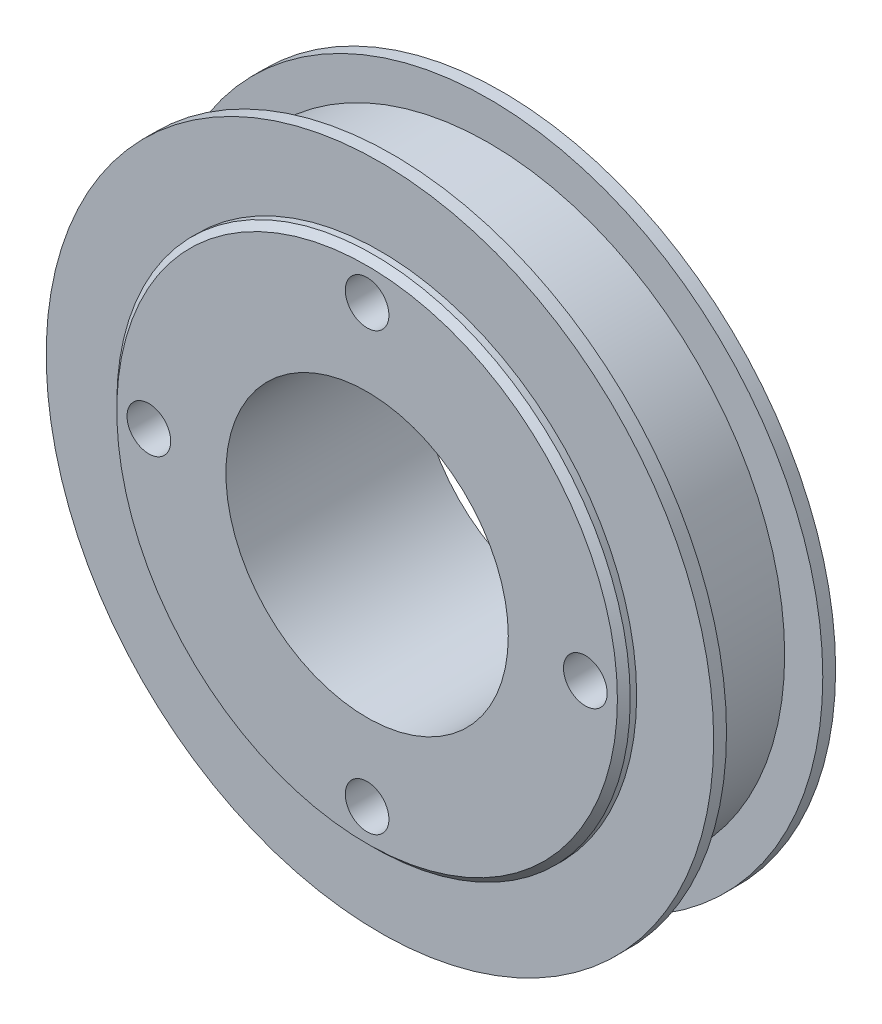
from build123d import *

# Parameters (mm, degrees)
SKETCH1_R                   = 13
BOSS_EXTRUDE1_DEPTH         = 3.5
SKETCH2_R                   = 20
BOSS_EXTRUDE2_DEPTH         = 1
SKETCH3_R                   = 26
BOSS_EXTRUDE3_DEPTH         = 1
SKETCH4_R                   = 23.03
BOSS_EXTRUDE4_DEPTH         = 7.5
SKETCH5_R                   = 26
BOSS_EXTRUDE5_DEPTH         = 1
SKETCH6_R                   = 20
BOSS_EXTRUDE6_DEPTH         = 1
SKETCH7_R                   = 11
CUT_EXTRUDE1_DEPTH          = 40.711459303
TAP_DRILL_FOR_M3X0_5_TAP1_D = 3.4
CHAMFER1_SIZE               = 0.5


with BuildPart() as part:
    # Sketch1 → Boss-Extrude1 (new body)
    with BuildSketch(Plane.XY):
        Circle(SKETCH1_R)
    extrude(amount=BOSS_EXTRUDE1_DEPTH)

    # Sketch2 → Boss-Extrude2 (add)
    with BuildSketch(Plane.XY.offset(3.5)):
        Circle(SKETCH2_R)
    extrude(amount=BOSS_EXTRUDE2_DEPTH)

    # Sketch3 → Boss-Extrude3 (add)
    with BuildSketch(Plane.XY.offset(4.5)):
        Circle(SKETCH3_R)
    extrude(amount=BOSS_EXTRUDE3_DEPTH)

    # Sketch4 → Boss-Extrude4 (add)
    with BuildSketch(Plane.XY.offset(5.5)):
        Circle(SKETCH4_R)
    extrude(amount=BOSS_EXTRUDE4_DEPTH)

    # Sketch5 → Boss-Extrude5 (add)
    with BuildSketch(Plane.XY.offset(13)):
        Circle(SKETCH5_R)
    extrude(amount=BOSS_EXTRUDE5_DEPTH)

    # Sketch6 → Boss-Extrude6 (add)
    with BuildSketch(Plane.XY.offset(14)):
        Circle(SKETCH6_R)
    extrude(amount=BOSS_EXTRUDE6_DEPTH)

    # Sketch7 → Cut-Extrude1 (cut, through all)
    with BuildSketch(Plane.XY.offset(15)):
        Circle(SKETCH7_R)
    extrude(amount=-CUT_EXTRUDE1_DEPTH, mode=Mode.SUBTRACT)

    # Tap Drill for M3x0.5 Tap1 (through all)
    with Locations(Plane(origin=(0, 0, 3.5), x_dir=(-1, 0, 0), z_dir=(0, 0, -1))):
        with Locations((0, 17), (17, 0), (0, -17), (-17, 0)):
            Hole(TAP_DRILL_FOR_M3X0_5_TAP1_D / 2)

    # Chamfer1
    chamfer1_edges = [part.edges().sort_by_distance(p)[0] for p in [
        (-20, 0, 15),
    ]]
    chamfer(chamfer1_edges, length=CHAMFER1_SIZE)


solid = part.part
